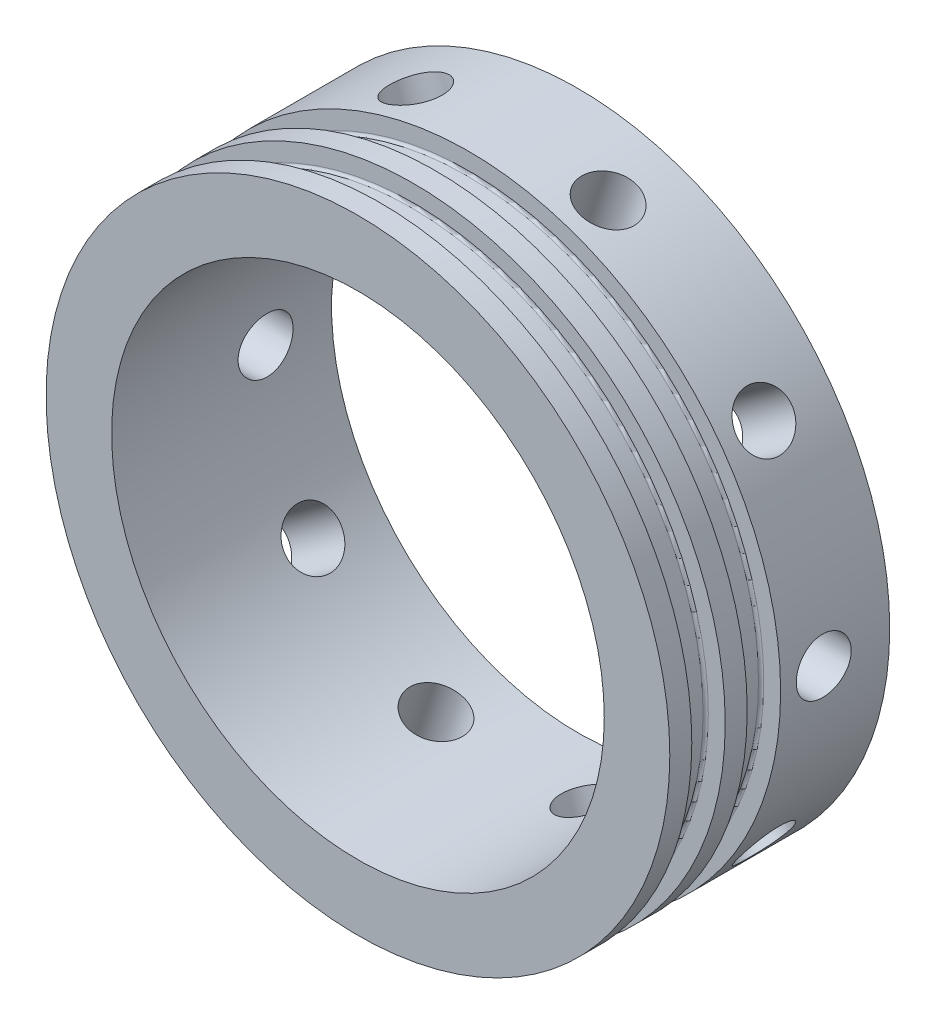
from build123d import *

# Parameters (mm, degrees)
SKETCH1_R                    = 45.0215
SKETCH1_R_2                  = 35.56
BOSS_EXTRUDE1_DEPTH          = 31.75
F_3_8_16_TAPPED_HOLE1_REACH  = 107.559
F_3_8_16_TAPPED_HOLE1_BORE_R = 3.96875
CIRPATTERN1_COUNT            = 10


with BuildPart() as part:
    # Sketch1 → Boss-Extrude1 (new body)
    with BuildSketch(Plane.XY):
        Circle(SKETCH1_R)
        Circle(SKETCH1_R_2, mode=Mode.SUBTRACT)
    extrude(amount=BOSS_EXTRUDE1_DEPTH)

    # 3/8-16 Tapped Hole1 bore → 3/8-16 Tapped Hole1 (cut, up to next)
    with BuildSketch(Plane(origin=(45.0215, 0, 0), x_dir=(0, 0, -1), z_dir=(1, 0, 0)), mode=Mode.PRIVATE) as f_3_8_16_tapped_hole1_sk1:
        with Locations((-9.525, 0)):
            Circle(F_3_8_16_TAPPED_HOLE1_BORE_R)
    f_3_8_16_tapped_hole1_tool1 = extrude(f_3_8_16_tapped_hole1_sk1.sketch, amount=-F_3_8_16_TAPPED_HOLE1_REACH, mode=Mode.PRIVATE) & part.part
    f_3_8_16_tapped_hole1 = f_3_8_16_tapped_hole1_tool1.solids().sort_by_distance((45.0215, 0, 9.525))[0]
    add(f_3_8_16_tapped_hole1, mode=Mode.SUBTRACT)

    # CirPattern1: 3/8-16 Tapped Hole1 ×10 about axis
    cirpattern1_axis = Axis((0, 0, 31.75), (0, 0, -1))
    for i in range(1, CIRPATTERN1_COUNT):
        add(f_3_8_16_tapped_hole1.rotate(cirpattern1_axis, i * 360 / CIRPATTERN1_COUNT), mode=Mode.SUBTRACT)

    # Sketch5 → Cut-Revolve1 (revolve, cut)
    with BuildSketch(Plane(origin=(0, 0, 0), x_dir=(0, 0, -1), z_dir=(1, 0, 0)), mode=Mode.PRIVATE) as cut_revolve1_sk:
        with BuildLine():
            Line((-23.749, 45.0215), (-28.575, 45.0215))
            Line((-28.575, 45.0215), (-28.575, 42.5831))
            ThreePointArc((-28.575, 42.5831), (-28.463407684, 42.313692316), (-28.194, 42.2021))
            Line((-28.194, 42.2021), (-24.13, 42.2021))
            ThreePointArc((-24.13, 42.2021), (-23.860592316, 42.313692316), (-23.749, 42.5831))
            Line((-23.749, 42.5831), (-23.749, 45.0215))
        make_face()
        with BuildLine():
            Line((-15.748, 45.0215), (-20.574, 45.0215))
            Line((-20.574, 45.0215), (-20.574, 42.5831))
            ThreePointArc((-20.574, 42.5831), (-20.462407684, 42.313692316), (-20.193, 42.2021))
            Line((-20.193, 42.2021), (-16.129, 42.2021))
            ThreePointArc((-16.129, 42.2021), (-15.859592316, 42.313692316), (-15.748, 42.5831))
            Line((-15.748, 42.5831), (-15.748, 45.0215))
        make_face()
    revolve(cut_revolve1_sk.sketch.rotate(Axis((0, 0, 31.75), (0, 0, -1)), 90), axis=Axis((0, 0, 31.75), (0, 0, -1)), mode=Mode.SUBTRACT)


solid = part.part
